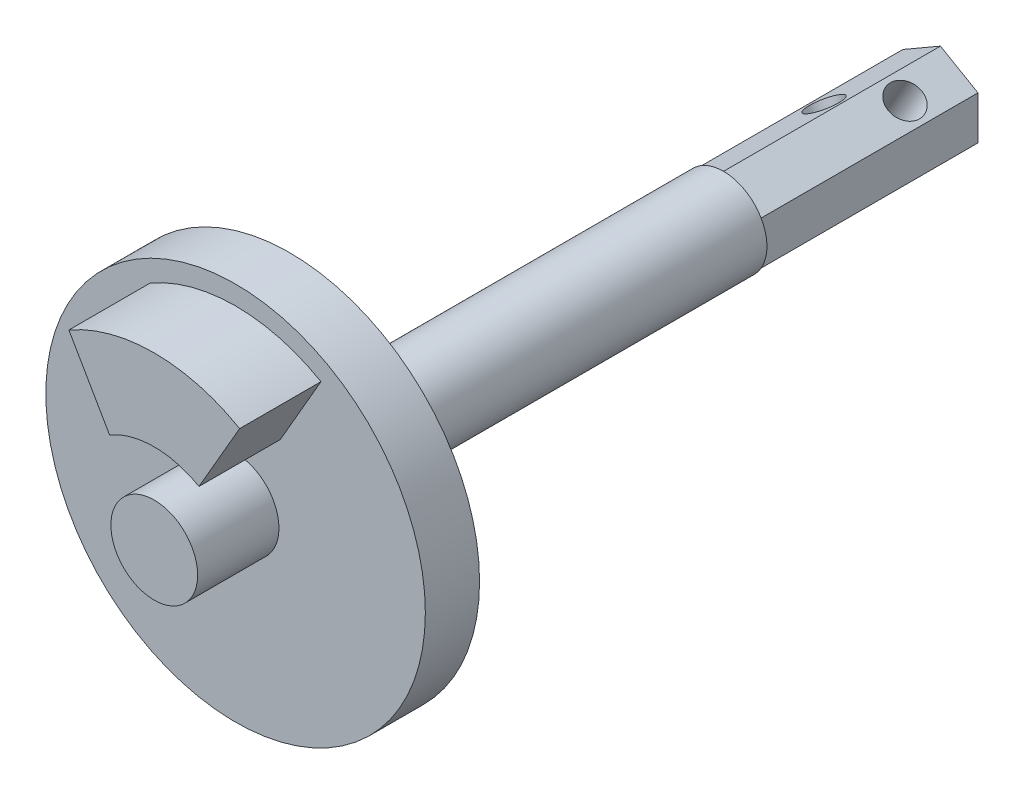
from build123d import *

# Parameters (mm, degrees)
SKETCH1_R           = 17.5
BOSS_EXTRUDE1_DEPTH = 2.5
BOSS_EXTRUDE2_DEPTH = 7.5
SKETCH3_R           = 4
BOSS_EXTRUDE3_DEPTH = 7.5
BOSS_EXTRUDE4_START = 40
SKETCH7_R           = 4
BOSS_EXTRUDE4_DEPTH = 40
BOSS_EXTRUDE5_DEPTH = 20
SKETCH10_R          = 1.55
CUT_EXTRUDE1_DEPTH  = 6.92820323
SKETCH11_R          = 1.55
CUT_EXTRUDE4_DEPTH  = 6.92820323


with BuildPart() as part:
    # Sketch1 → Boss-Extrude1 (new, symmetric)
    with BuildSketch(Plane.XY):
        Circle(SKETCH1_R)
    extrude(amount=BOSS_EXTRUDE1_DEPTH, both=True)

    # Sketch2 → Boss-Extrude2 (add)
    with BuildSketch(Plane.XY.offset(2.5)):
        with BuildLine():
            Line((7.875, 13.63990011), (4.125, 7.144709581))
            ThreePointArc((4.125, 7.144709581), (0, 8.25), (-4.125, 7.144709581))
            Line((-4.125, 7.144709581), (-7.875, 13.63990011))
            ThreePointArc((-7.875, 13.63990011), (0, 15.75), (7.875, 13.63990011))
        make_face()
    extrude(amount=BOSS_EXTRUDE2_DEPTH)

    # Sketch3 → Boss-Extrude3 (add)
    with BuildSketch(Plane.XY.offset(2.5)):
        Circle(SKETCH3_R)
    extrude(amount=BOSS_EXTRUDE3_DEPTH)

    # Sketch7 → Boss-Extrude4 (add)
    with BuildSketch(Plane(origin=(0, 0, -2.5), x_dir=(-1, 0, 0), z_dir=(0, 0, -1)).offset(BOSS_EXTRUDE4_START)):
        with Locations(Location((0, 0, 0), (0, 0, 180))):
            Circle(SKETCH7_R)
    extrude(amount=-BOSS_EXTRUDE4_DEPTH)

    # Sketch9 → Boss-Extrude5 (add)
    with BuildSketch(Plane(origin=(0, 0, -42.5), x_dir=(-1, 0, 0), z_dir=(0, 0, -1))):
        Polygon((0, 4), (-3.464101615, 2), (-3.464101615, -2), (0, -4), (3.464101615, -2), (3.464101615, 2), align=None)
    extrude(amount=BOSS_EXTRUDE5_DEPTH)

    # Sketch10 → Cut-Extrude1 (cut)
    with BuildSketch(Plane(origin=(-1.732050808, -3, 0), x_dir=(0.866025403784435, -0.5000000000000062, 0), z_dir=(-0.5000000000000062, -0.866025403784435, 0))):
        with Locations((0, -57.5)):
            Circle(SKETCH10_R)
    extrude(amount=-CUT_EXTRUDE1_DEPTH, mode=Mode.SUBTRACT)

    # Sketch11 → Cut-Extrude4 (cut)
    with BuildSketch(Plane(origin=(1.732050808, -3, 0), x_dir=(0, 0, 1), z_dir=(-0.49999999999999717, 0.8660254037844404, 0))):
        with Locations(Location((-53.5, 0, 0), (0, 0, 90))):
            Circle(SKETCH11_R)
    extrude(amount=CUT_EXTRUDE4_DEPTH, mode=Mode.SUBTRACT)


solid = part.part
